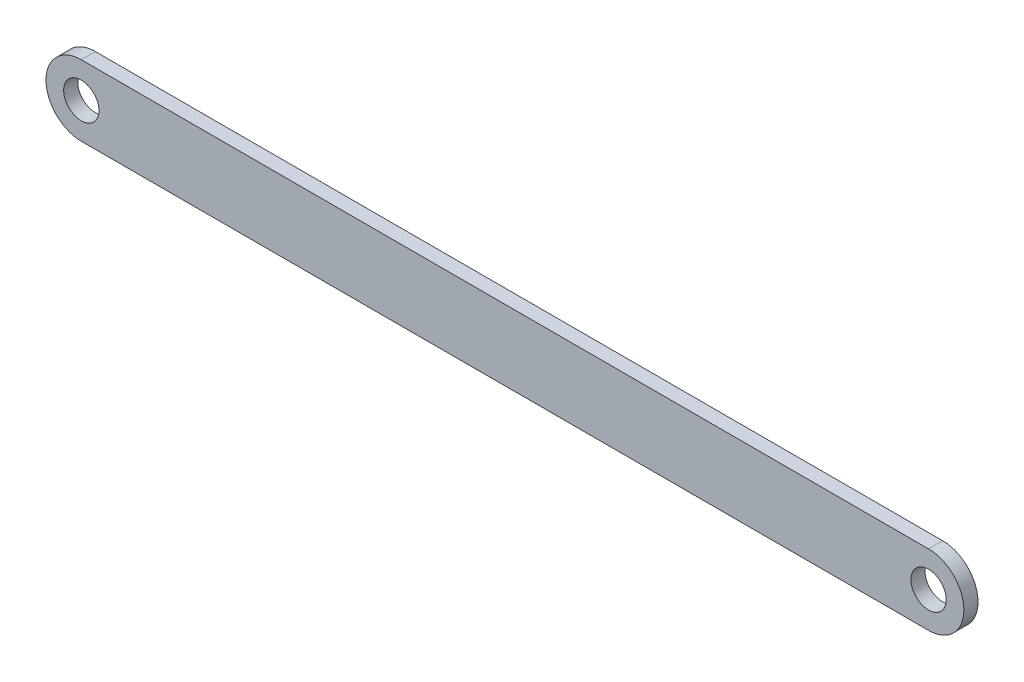
from build123d import *

# Parameters (mm, degrees)
SKETCH1_R           = 3.175
BOSS_EXTRUDE1_DEPTH = 2.54


with BuildPart() as part:
    # Sketch1 → Boss-Extrude1 (new body)
    with BuildSketch(Plane.XY):
        with BuildLine():
            Line((-76.2, 6.35), (76.2, 6.35))
            ThreePointArc((76.2, 6.35), (82.55, 0), (76.2, -6.35))
            Line((76.2, -6.35), (-76.2, -6.35))
            ThreePointArc((-76.2, -6.35), (-82.55, 0), (-76.2, 6.35))
        make_face()
        with Locations((76.2, 0)):
            Circle(SKETCH1_R, mode=Mode.SUBTRACT)
        with Locations((-76.2, 0)):
            Circle(SKETCH1_R, mode=Mode.SUBTRACT)
    extrude(amount=BOSS_EXTRUDE1_DEPTH)


solid = part.part
